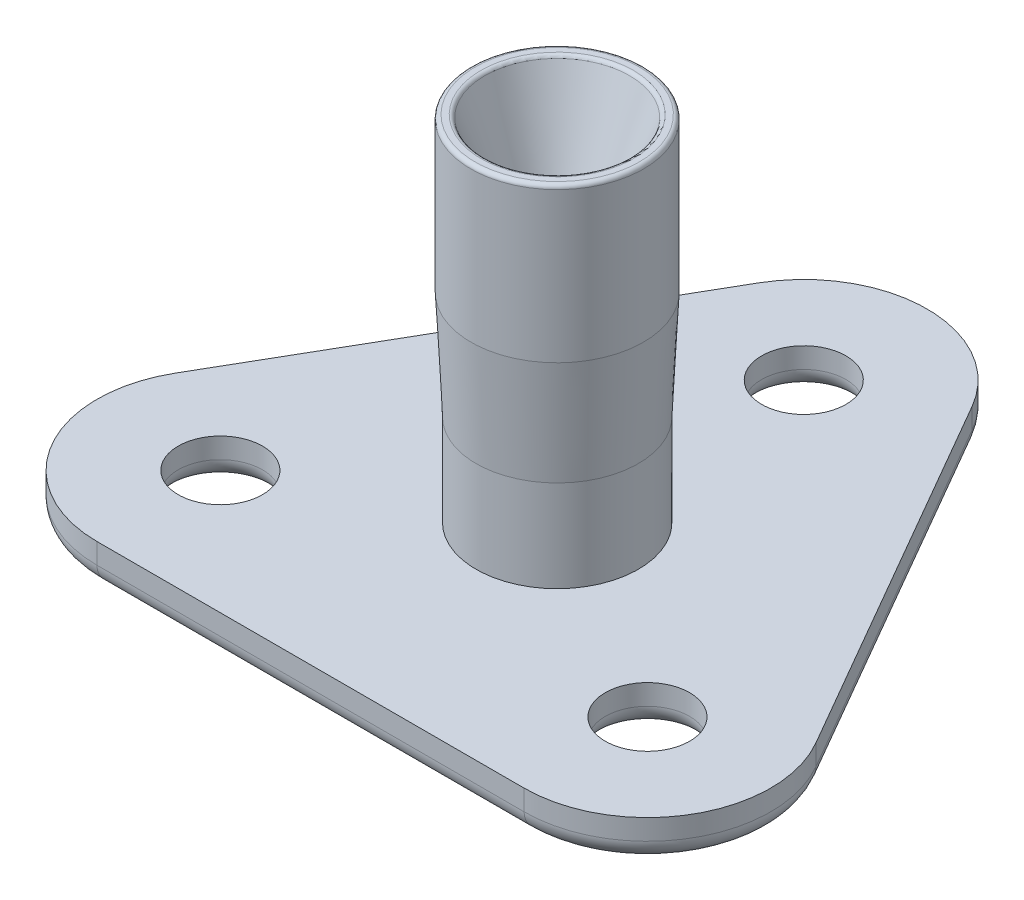
from build123d import *

# Parameters (mm, degrees)
SKETCH2_R           = 8
SKETCH2_R_2         = 2.05
BOSS_EXTRUDE1_DEPTH = 2
FILLET3_R           = 0.2
FILLET4_R           = 1


with BuildPart() as part:
    # Sketch1 → Revolve1 (revolve)
    with BuildSketch(Plane.XY, mode=Mode.PRIVATE) as revolve1_sk:
        Polygon((-1.05, 12.24192198), (-3.576544919, 19.194154715), (-4.2, 19.194154715), (-4.2, 11.697668557), (-3.95, 6.45510688), (-3.95, 2), (-8, 2), (-8, 0), (-2.807283763, 0), (-1.05, 2), align=None)
    revolve(revolve1_sk.sketch.rotate(Axis((0, 0, 0), (0, 1, 0)), 270), axis=Axis((0, 0, 0), (0, 1, 0)))

    # Sketch2 → Boss-Extrude1 (add)
    with BuildSketch(Plane(origin=(0, 0, 0), x_dir=(1, 0, 0), z_dir=(0, 1, 0))):
        with BuildLine():
            ThreePointArc((-15.588457268, -3), (-15.588457268, -9), (-10.392304845, -12))
            Line((-10.392304845, -12), (10.392304845, -12))
            ThreePointArc((10.392304845, -12), (15.588457268, -9), (15.588457268, -3))
            Line((15.588457268, -3), (5.196152423, 15))
            ThreePointArc((5.196152423, 15), (0, 18), (-5.196152423, 15))
            Line((-5.196152423, 15), (-15.588457268, -3))
        make_face()
        Circle(SKETCH2_R, mode=Mode.SUBTRACT)
        with Locations(Location((-10.392304845, -6, 0), (0, 0, 90))):
            Circle(SKETCH2_R_2, mode=Mode.SUBTRACT)
        with Locations(Location((10.392304845, -6, 0), (0, 0, 90))):
            Circle(SKETCH2_R_2, mode=Mode.SUBTRACT)
        with Locations(Location((0, 12, 0), (0, 0, 90))):
            Circle(SKETCH2_R_2, mode=Mode.SUBTRACT)
    extrude(amount=BOSS_EXTRUDE1_DEPTH)

    # Fillet3
    fillet3_edges = [part.edges().sort_by_distance(p)[0] for p in [
        (0, 19.194154715, 4.2),
        (0, 19.194154715, 3.576544919),
    ]]
    fillet(fillet3_edges, radius=FILLET3_R)

    # Fillet4
    fillet4_edges = [part.edges().sort_by_distance(p)[0] for p in [
        (-15.588457268, 0, 9),
        (0, 0, 12),
        (15.588457268, 0, 9),
        (10.392304845, 0, -6),
        (0, 0, -18),
        (-10.392304845, 0, -6),
        (0, 0, -9.95),
        (10.392304845, 0, 8.05),
        (-10.392304845, 0, 8.05),
        (0, 0, 2.807283763),
    ]]
    fillet(fillet4_edges, radius=FILLET4_R)


solid = part.part
